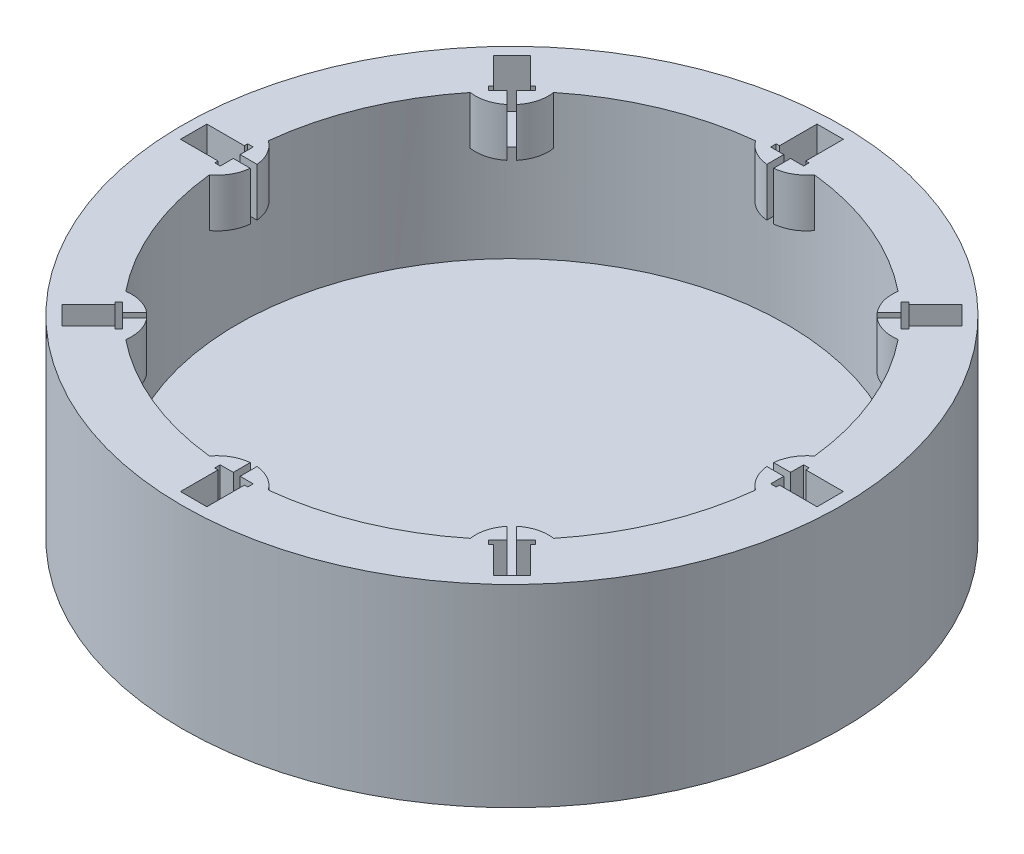
from build123d import *

# Parameters (mm, degrees)
SKETCH1_R           = 38.1
BOSS_EXTRUDE1_DEPTH = 5.588
SKETCH5_R           = 38.1
SKETCH5_R_2         = 31.75
BOSS_EXTRUDE3_DEPTH = 16.764
CUT_EXTRUDE2_START  = -5.588
CUT_EXTRUDE2_DEPTH  = 5.588
BOSS_EXTRUDE4_START = -5.588
BOSS_EXTRUDE4_DEPTH = 5.588
CIRPATTERN1_COUNT   = 8


with BuildPart() as part:
    # Sketch1 → Boss-Extrude1 (new body)
    with BuildSketch(Plane(origin=(0, 0, 0), x_dir=(1, 0, 0), z_dir=(0, 1, 0))):
        Circle(SKETCH1_R)
    extrude(amount=BOSS_EXTRUDE1_DEPTH)

    # Sketch5 → Boss-Extrude3 (add)
    with BuildSketch(Plane(origin=(0, 5.588, 0), x_dir=(1, 0, 0), z_dir=(0, 1, 0))):
        Circle(SKETCH5_R)
        Circle(SKETCH5_R_2, mode=Mode.SUBTRACT)
    extrude(amount=BOSS_EXTRUDE3_DEPTH)

    # Sketch6 → Cut-Extrude2 (cut)
    with BuildSketch(Plane(origin=(0, 22.352, 0), x_dir=(1, 0, 0), z_dir=(0, 1, 0)).offset(CUT_EXTRUDE2_START)):
        with BuildLine():
            Line((-1.524, -32.452967385), (-1.524, -36.793402908))
            Line((-1.524, -36.793402908), (1.524, -36.793402908))
            Line((1.524, -36.793402908), (1.524, -32.452967385))
            Line((1.524, -32.452967385), (1.907415329, -32.452967385))
            Line((1.907415329, -32.452967385), (1.907415329, -31.817967385))
            Line((1.907415329, -31.817967385), (0.393317037, -31.817967385))
            Line((0.393317037, -31.817967385), (0.393317037, -31.747563713))
            ThreePointArc((0.393317037, -31.747563713), (0, -31.75), (-0.393317037, -31.747563713))
            Line((-0.393317037, -31.747563713), (-0.393317037, -31.817967385))
            Line((-0.393317037, -31.817967385), (-1.907415329, -31.817967385))
            Line((-1.907415329, -31.817967385), (-1.907415329, -32.452967385))
            Line((-1.907415329, -32.452967385), (-1.524, -32.452967385))
        make_face()
    cut_extrude2 = extrude(amount=CUT_EXTRUDE2_DEPTH, mode=Mode.SUBTRACT)

    # Sketch6<4> → Boss-Extrude4 (add)
    with BuildSketch(Plane(origin=(0, 22.352, 0), x_dir=(1, 0, 0), z_dir=(0, 1, 0)).offset(BOSS_EXTRUDE4_START)):
        with BuildLine():
            ThreePointArc((-3.407999769, -31.566565185), (-1.90281173, -31.69292993), (-0.393317037, -31.747563713))
            Line((-0.393317037, -31.747563713), (-0.393317037, -29.857063133))
            ThreePointArc((-0.393317037, -29.857063133), (-2.08401096, -30.388474513), (-3.407999769, -31.566565185))
        make_face()
        with BuildLine():
            ThreePointArc((0.393317037, -31.747563713), (1.90281173, -31.69292993), (3.407999769, -31.566565185))
            ThreePointArc((3.407999769, -31.566565185), (2.08401096, -30.388474513), (0.393317037, -29.857063133))
            Line((0.393317037, -29.857063133), (0.393317037, -31.747563713))
        make_face()
    boss_extrude4 = extrude(amount=BOSS_EXTRUDE4_DEPTH)

    # CirPattern1: Cut-Extrude2, Boss-Extrude4 ×8 about axis
    cirpattern1_axis = Axis((0, 22.352, 0), (0, 1, 0))
    add([cut_extrude2.rotate(cirpattern1_axis, i * 360 / CIRPATTERN1_COUNT) for i in range(1, CIRPATTERN1_COUNT)], mode=Mode.SUBTRACT)
    add([boss_extrude4.rotate(cirpattern1_axis, i * 360 / CIRPATTERN1_COUNT) for i in range(1, CIRPATTERN1_COUNT)])


solid = part.part
